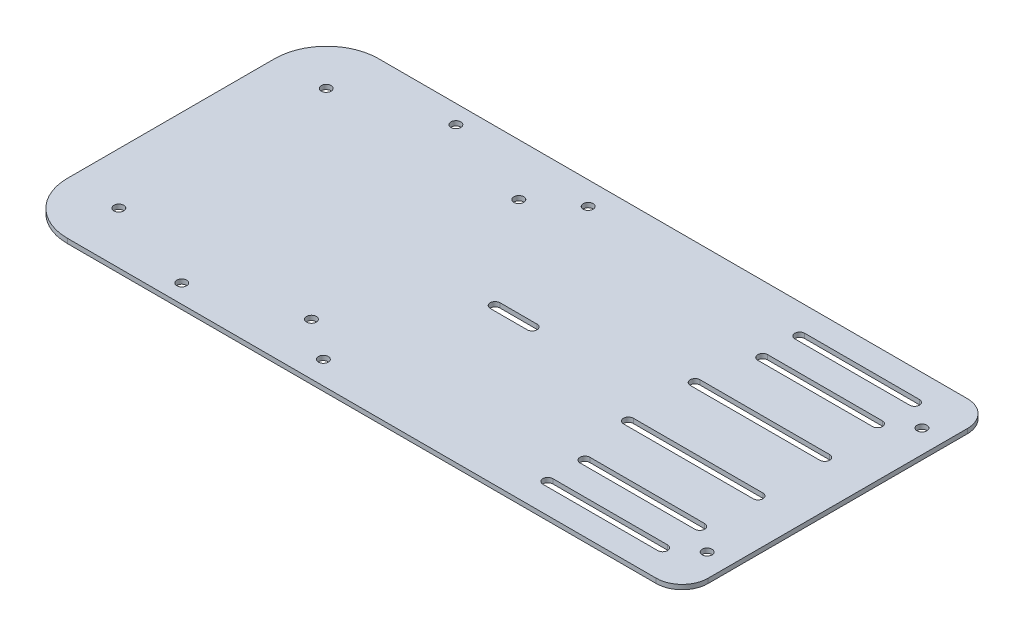
from build123d import *

# Parameters (mm, degrees)
SKETCH1_R           = 3.3782
BOSS_EXTRUDE1_DEPTH = 3.175
SKETCH4_W           = 23.114
SKETCH4_H           = 213.36
CUT_EXTRUDE1_DEPTH  = 263.804276362
FILLET1_R           = 17.78
FILLET2_R           = 35.56


with BuildPart() as part:
    # Sketch1 → Boss-Extrude1 (new body)
    with BuildSketch(Plane(origin=(0, 0, 0), x_dir=(1, 0, 0), z_dir=(0, 1, 0))):
        Polygon((-240.157, 106.68), (240.157, 106.68), (240.157, -73.66), (240.157, -106.68), (-240.157, -106.68), align=None)
        with Locations(Location((224.282, -73.66, 0), (0, 0, 270))):
            Circle(SKETCH1_R, mode=Mode.SUBTRACT)
        with Locations(Location((-21.7805, -90.805, 0), (0, 0, 270))):
            Circle(SKETCH1_R, mode=Mode.SUBTRACT)
        with Locations(Location((-21.7805, 90.805, 0), (0, 0, 90))):
            Circle(SKETCH1_R, mode=Mode.SUBTRACT)
        with Locations(Location((224.282, 73.66, 0), (0, 0, 90))):
            Circle(SKETCH1_R, mode=Mode.SUBTRACT)
        with Locations(Location((-115.697, 93.98, 0), (0, 0, 270))):
            Circle(SKETCH1_R, mode=Mode.SUBTRACT)
        with Locations(Location((-115.697, -93.98, 0), (0, 0, 90))):
            Circle(SKETCH1_R, mode=Mode.SUBTRACT)
        with Locations(Location((-181.737, 71.12, 0), (0, 0, 270))):
            Circle(SKETCH1_R, mode=Mode.SUBTRACT)
        with Locations(Location((-49.657, 71.12, 0), (0, 0, 270))):
            Circle(SKETCH1_R, mode=Mode.SUBTRACT)
        with Locations(Location((-49.657, -71.12, 0), (0, 0, 90))):
            Circle(SKETCH1_R, mode=Mode.SUBTRACT)
        with Locations(Location((-181.737, -71.12, 0), (0, 0, 90))):
            Circle(SKETCH1_R, mode=Mode.SUBTRACT)
        with BuildLine():
            Line((119.507, -19.4818), (208.407, -19.4818))
            ThreePointArc((208.407, -19.4818), (211.7852, -22.86), (208.407, -26.2382))
            Line((208.407, -26.2382), (119.507, -26.2382))
            ThreePointArc((119.507, -26.2382), (116.1288, -22.86), (119.507, -19.4818))
        make_face(mode=Mode.SUBTRACT)
        with BuildLine():
            Line((119.507, 19.4818), (208.407, 19.4818))
            ThreePointArc((208.407, 19.4818), (211.7852, 22.86), (208.407, 26.2382))
            Line((208.407, 26.2382), (119.507, 26.2382))
            ThreePointArc((119.507, 26.2382), (116.1288, 22.86), (119.507, 19.4818))
        make_face(mode=Mode.SUBTRACT)
        with BuildLine():
            Line((127.762, -57.5818), (206.502, -57.5818))
            ThreePointArc((206.502, -57.5818), (209.8802, -60.96), (206.502, -64.3382))
            Line((206.502, -64.3382), (127.762, -64.3382))
            ThreePointArc((127.762, -64.3382), (124.3838, -60.96), (127.762, -57.5818))
        make_face(mode=Mode.SUBTRACT)
        with BuildLine():
            Line((127.762, -89.7382), (206.502, -89.7382))
            ThreePointArc((206.502, -89.7382), (209.8802, -86.36), (206.502, -82.9818))
            Line((206.502, -82.9818), (127.762, -82.9818))
            ThreePointArc((127.762, -82.9818), (124.3838, -86.36), (127.762, -89.7382))
        make_face(mode=Mode.SUBTRACT)
        with BuildLine():
            Line((127.762, 57.5818), (206.502, 57.5818))
            ThreePointArc((206.502, 57.5818), (209.8802, 60.96), (206.502, 64.3382))
            Line((206.502, 64.3382), (127.762, 64.3382))
            ThreePointArc((127.762, 64.3382), (124.3838, 60.96), (127.762, 57.5818))
        make_face(mode=Mode.SUBTRACT)
        with BuildLine():
            Line((127.762, 89.7382), (206.502, 89.7382))
            ThreePointArc((206.502, 89.7382), (209.8802, 86.36), (206.502, 82.9818))
            Line((206.502, 82.9818), (127.762, 82.9818))
            ThreePointArc((127.762, 82.9818), (124.3838, 86.36), (127.762, 89.7382))
        make_face(mode=Mode.SUBTRACT)
        with BuildLine():
            Line((5.207, 3.3782), (30.607, 3.3782))
            ThreePointArc((30.607, 3.3782), (33.9852, 0), (30.607, -3.3782))
            Line((30.607, -3.3782), (5.207, -3.3782))
            ThreePointArc((5.207, -3.3782), (1.8288, 0), (5.207, 3.3782))
        make_face(mode=Mode.SUBTRACT)
    extrude(amount=BOSS_EXTRUDE1_DEPTH)

    # Sketch4 → Cut-Extrude1 (cut, through all)
    with BuildSketch(Plane(origin=(0, 3.175, 0), x_dir=(1, 0, 0), z_dir=(0, 1, 0))):
        with Locations((-228.6, 0)):
            Rectangle(SKETCH4_W, SKETCH4_H)
    extrude(amount=-CUT_EXTRUDE1_DEPTH, mode=Mode.SUBTRACT)

    # Fillet1
    fillet1_edges = [part.edges().sort_by_distance(p)[0] for p in [
        (240.157, 1.5875, 106.68),
        (240.157, 1.5875, -106.68),
    ]]
    fillet(fillet1_edges, radius=FILLET1_R)

    # Fillet2
    fillet2_edges = [part.edges().sort_by_distance(p)[0] for p in [
        (-217.043, 1.5875, -106.68),
        (-217.043, 1.5875, 106.68),
    ]]
    fillet(fillet2_edges, radius=FILLET2_R)


solid = part.part
